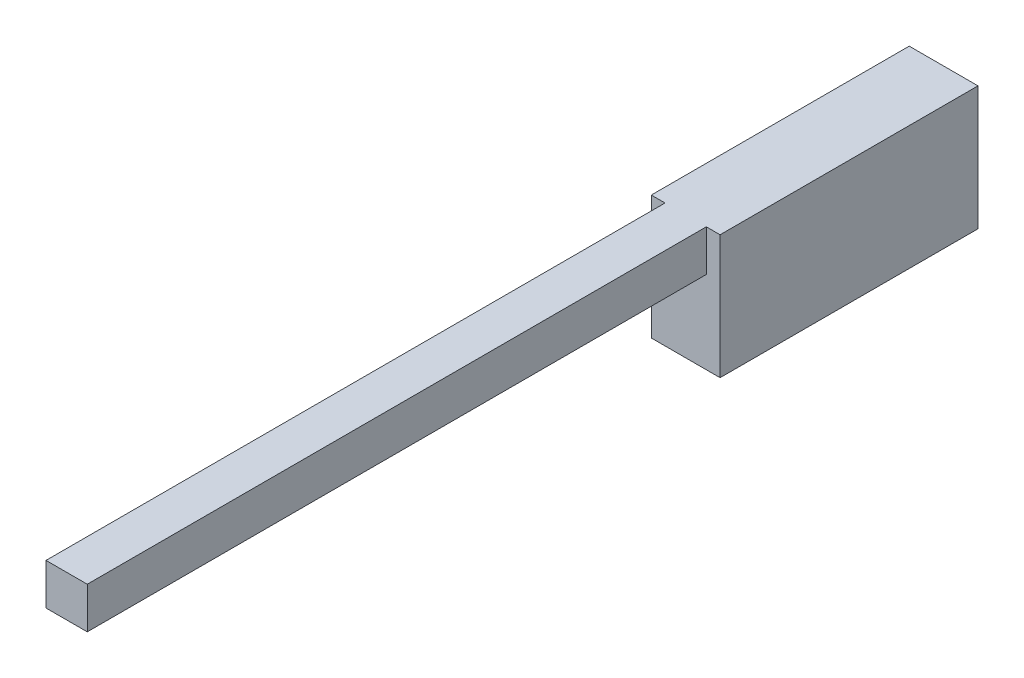
from build123d import *

# Parameters (mm, degrees)
SKETCH2_W           = 20
SKETCH2_H           = 36
BOSS_EXTRUDE1_DEPTH = 75
SKETCH3_W           = 12
SKETCH3_H           = 12
BOSS_EXTRUDE2_DEPTH = 180


with BuildPart() as part:
    # Sketch2 → Boss-Extrude1 (new body)
    with BuildSketch(Plane.XY):
        with Locations((10, 18)):
            Rectangle(SKETCH2_W, SKETCH2_H)
    extrude(amount=BOSS_EXTRUDE1_DEPTH)

    # Sketch3 → Boss-Extrude2 (add)
    with BuildSketch(Plane.XY.offset(75)):
        with Locations((10, 30)):
            Rectangle(SKETCH3_W, SKETCH3_H)
    extrude(amount=BOSS_EXTRUDE2_DEPTH)


solid = part.part
